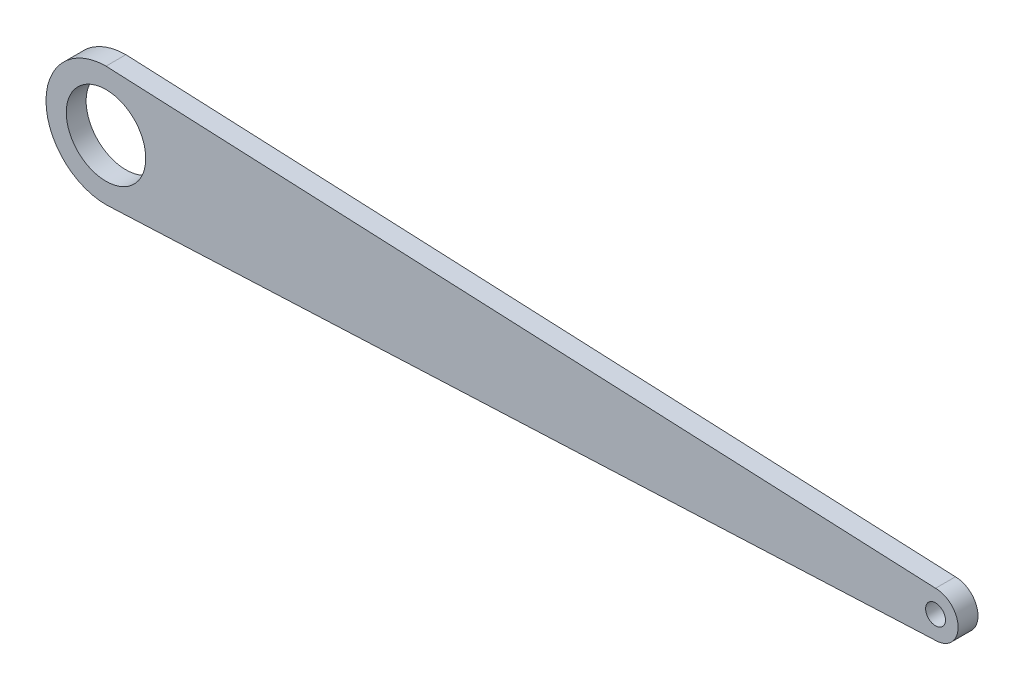
from build123d import *

# Parameters (mm, degrees)
ESBO_O1_R                = 10
ESBO_O1_R_2              = 2.5
RESSALTO_EXTRUS_O1_DEPTH = 5


with BuildPart() as part:
    # Esboço1 → Ressalto-extrusão1 (new body)
    with BuildSketch(Plane.XY):
        with BuildLine():
            Line((-35.026455026, 15.098793303), (173.713544974, 5.685100403))
            ThreePointArc((173.713544974, 5.685100403), (179.398645377, 0), (173.713544974, -5.685100403))
            Line((173.713544974, -5.685100403), (-35.026455026, -15.098793303))
            ThreePointArc((-35.026455026, -15.098793303), (-50.12524833, 0), (-35.026455026, 15.098793303))
        make_face()
        with Locations((-35.026455026, 0)):
            Circle(ESBO_O1_R, mode=Mode.SUBTRACT)
        with Locations((173.713544974, 0)):
            Circle(ESBO_O1_R_2, mode=Mode.SUBTRACT)
    extrude(amount=RESSALTO_EXTRUS_O1_DEPTH)


solid = part.part
